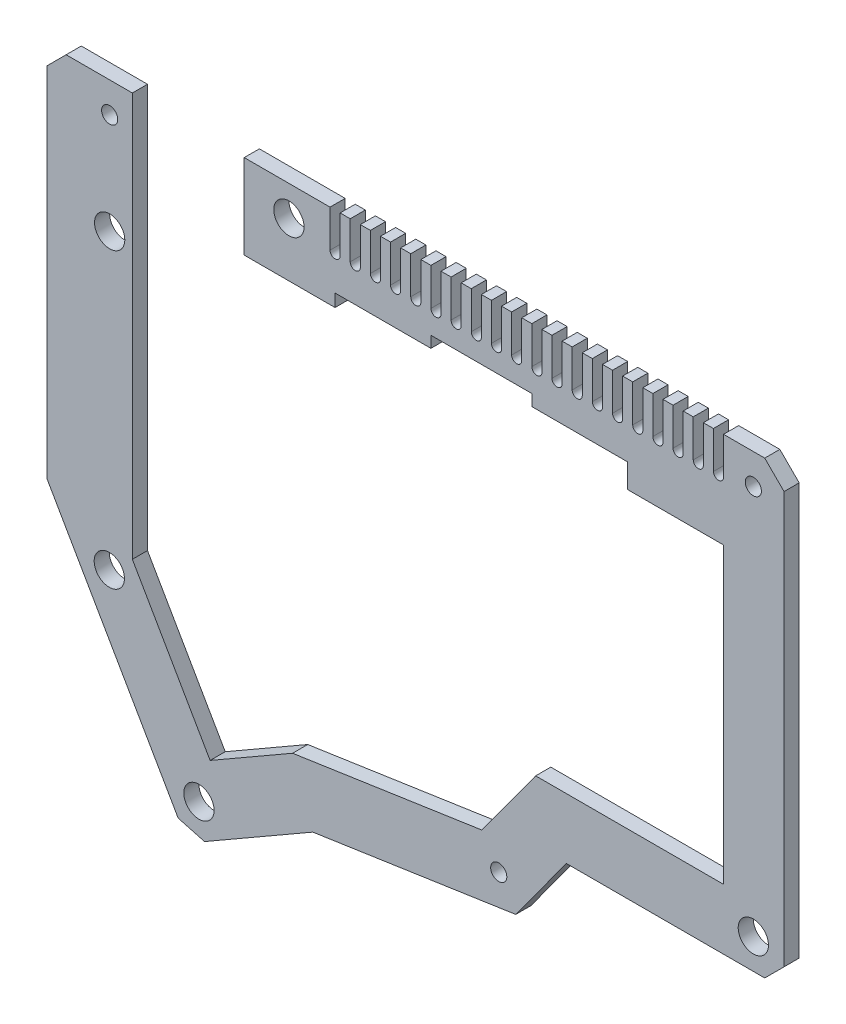
from build123d import *

# Parameters (mm, degrees)
BOSS_EXTRU_2_DEPTH      = 3
ENL_V_MAT_EXTRU_1_DEPTH = 3
ESQUISSE3_R             = 3
ESQUISSE3_R_2           = 1.6
ENL_V_MAT_EXTRU_3_DEPTH = 10


with BuildPart() as part:
    # Esquisse1 → Boss.-Extru.2 (new body)
    with BuildSketch(Plane.XY):
        Polygon((-140.02282508, -78.342807898), (-126.111124489, -102.556497988), (-109.761976756, -93.1463556), (-72.263087593, -87.572177036), (-61.577157206, -72.933633781), (-24.339106961, -72.933633781), (-24.339106961, -14.679643994), (-43.341802282, -14.679643994), (-43.341802282, -9.929307079), (-62.343149943, -9.929307079), (-62.343149943, -7.681038584), (-82.344426674, -7.679926158), (-82.344426674, -9.929307079), (-101.345774335, -9.929307079), (-101.345774335, -12.429484403), (-119.346382005, -12.429484403), (-119.346315028, 4.320852512), (-103.340940531, 4.320852512), (-96.344482292, 4.320852512), (-16.168669469, 4.316393314), (-12.339106961, 0.486617808), (-12.339106961, -81.105206657), (-16.167534085, -84.933633781), (-55.479847181, -84.933633781), (-65.531582138, -98.70339941), (-105.747438988, -104.681452952), (-127.216265437, -117.03834868), (-132.440036759, -115.628996046), (-158.478985875, -70.307502815), (-158.478985875, -3.429484403), (-158.478985875, 0.492425388), (-154.65055875, 4.320852512), (-141.52282508, 4.320852512), (-141.52282508, -75.180151251), (-141.52282508, -75.732017442), (-140.889904197, -76.833633309), align=None)
    extrude(amount=BOSS_EXTRU_2_DEPTH)

    # Esquisse2 → Enlèv. mat.-Extru.1 (cut)
    with BuildSketch(Plane.XY.offset(3)):
        with BuildLine():
            Line((-24.339106961, 4.316903353), (-24.339106961, -3.069258416))
            ThreePointArc((-24.339106961, -3.069258416), (-25.339106961, -4.069258416), (-26.339106961, -3.069258416))
            Line((-26.339106961, -3.069258416), (-26.339106961, 4.316903353))
            ThreePointArc((-26.339106961, 4.316903353), (-25.339106961, 5.316903353), (-24.339106961, 4.316903353))
        make_face()
        with BuildLine():
            Line((-28.339106961, 4.316903353), (-28.339106961, -3.069258416))
            ThreePointArc((-28.339106961, -3.069258416), (-29.339106961, -4.069258416), (-30.339106961, -3.069258416))
            Line((-30.339106961, -3.069258416), (-30.339106961, 4.316903353))
            ThreePointArc((-30.339106961, 4.316903353), (-29.339106961, 5.316903353), (-28.339106961, 4.316903353))
        make_face()
        with BuildLine():
            Line((-32.339106961, 4.316903353), (-32.339106961, -3.069258416))
            ThreePointArc((-32.339106961, -3.069258416), (-33.339106961, -4.069258416), (-34.339106961, -3.069258416))
            Line((-34.339106961, -3.069258416), (-34.339106961, 4.316903353))
            ThreePointArc((-34.339106961, 4.316903353), (-33.339106961, 5.316903353), (-32.339106961, 4.316903353))
        make_face()
        with BuildLine():
            Line((-36.339106961, 4.316903353), (-36.339106961, -3.069258416))
            ThreePointArc((-36.339106961, -3.069258416), (-37.339106961, -4.069258416), (-38.339106961, -3.069258416))
            Line((-38.339106961, -3.069258416), (-38.339106961, 4.316903353))
            ThreePointArc((-38.339106961, 4.316903353), (-37.339106961, 5.316903353), (-36.339106961, 4.316903353))
        make_face()
        with BuildLine():
            Line((-40.339106961, 4.316903353), (-40.339106961, -3.069258416))
            ThreePointArc((-40.339106961, -3.069258416), (-41.339106961, -4.069258416), (-42.339106961, -3.069258416))
            Line((-42.339106961, -3.069258416), (-42.339106961, 4.316903353))
            ThreePointArc((-42.339106961, 4.316903353), (-41.339106961, 5.316903353), (-40.339106961, 4.316903353))
        make_face()
        with BuildLine():
            Line((-44.339106961, 4.316903353), (-44.339106961, -3.069258416))
            ThreePointArc((-44.339106961, -3.069258416), (-45.339106961, -4.069258416), (-46.339106961, -3.069258416))
            Line((-46.339106961, -3.069258416), (-46.339106961, 4.316903353))
            ThreePointArc((-46.339106961, 4.316903353), (-45.339106961, 5.316903353), (-44.339106961, 4.316903353))
        make_face()
        with BuildLine():
            Line((-48.339106961, 4.316903353), (-48.339106961, -3.069258416))
            ThreePointArc((-48.339106961, -3.069258416), (-49.339106961, -4.069258416), (-50.339106961, -3.069258416))
            Line((-50.339106961, -3.069258416), (-50.339106961, 4.316903353))
            ThreePointArc((-50.339106961, 4.316903353), (-49.339106961, 5.316903353), (-48.339106961, 4.316903353))
        make_face()
        with BuildLine():
            Line((-52.339106961, 4.316903353), (-52.339106961, -3.069258416))
            ThreePointArc((-52.339106961, -3.069258416), (-53.339106961, -4.069258416), (-54.339106961, -3.069258416))
            Line((-54.339106961, -3.069258416), (-54.339106961, 4.316903353))
            ThreePointArc((-54.339106961, 4.316903353), (-53.339106961, 5.316903353), (-52.339106961, 4.316903353))
        make_face()
        with BuildLine():
            Line((-56.339106961, 4.316903353), (-56.339106961, -3.069258416))
            ThreePointArc((-56.339106961, -3.069258416), (-57.339106961, -4.069258416), (-58.339106961, -3.069258416))
            Line((-58.339106961, -3.069258416), (-58.339106961, 4.316903353))
            ThreePointArc((-58.339106961, 4.316903353), (-57.339106961, 5.316903353), (-56.339106961, 4.316903353))
        make_face()
        with BuildLine():
            Line((-60.339106961, 4.316903353), (-60.339106961, -3.069258416))
            ThreePointArc((-60.339106961, -3.069258416), (-61.339106961, -4.069258416), (-62.339106961, -3.069258416))
            Line((-62.339106961, -3.069258416), (-62.339106961, 4.316903353))
            ThreePointArc((-62.339106961, 4.316903353), (-61.339106961, 5.316903353), (-60.339106961, 4.316903353))
        make_face()
        with BuildLine():
            Line((-64.339106961, 4.316903353), (-64.339106961, -3.069258416))
            ThreePointArc((-64.339106961, -3.069258416), (-65.339106961, -4.069258416), (-66.339106961, -3.069258416))
            Line((-66.339106961, -3.069258416), (-66.339106961, 4.316903353))
            ThreePointArc((-66.339106961, 4.316903353), (-65.339106961, 5.316903353), (-64.339106961, 4.316903353))
        make_face()
        with BuildLine():
            Line((-68.339106961, 4.316903353), (-68.339106961, -3.069258416))
            ThreePointArc((-68.339106961, -3.069258416), (-69.339106961, -4.069258416), (-70.339106961, -3.069258416))
            Line((-70.339106961, -3.069258416), (-70.339106961, 4.316903353))
            ThreePointArc((-70.339106961, 4.316903353), (-69.339106961, 5.316903353), (-68.339106961, 4.316903353))
        make_face()
        with BuildLine():
            Line((-72.339106961, 4.316903353), (-72.339106961, -3.069258416))
            ThreePointArc((-72.339106961, -3.069258416), (-73.339106961, -4.069258416), (-74.339106961, -3.069258416))
            Line((-74.339106961, -3.069258416), (-74.339106961, 4.316903353))
            ThreePointArc((-74.339106961, 4.316903353), (-73.339106961, 5.316903353), (-72.339106961, 4.316903353))
        make_face()
        with BuildLine():
            Line((-76.339106961, 4.316903353), (-76.339106961, -3.069258416))
            ThreePointArc((-76.339106961, -3.069258416), (-77.339106961, -4.069258416), (-78.339106961, -3.069258416))
            Line((-78.339106961, -3.069258416), (-78.339106961, 4.316903353))
            ThreePointArc((-78.339106961, 4.316903353), (-77.339106961, 5.316903353), (-76.339106961, 4.316903353))
        make_face()
        with BuildLine():
            Line((-80.339106961, 4.316903353), (-80.339106961, -3.069258416))
            ThreePointArc((-80.339106961, -3.069258416), (-81.339106961, -4.069258416), (-82.339106961, -3.069258416))
            Line((-82.339106961, -3.069258416), (-82.339106961, 4.316903353))
            ThreePointArc((-82.339106961, 4.316903353), (-81.339106961, 5.316903353), (-80.339106961, 4.316903353))
        make_face()
        with BuildLine():
            Line((-84.339106961, 4.316903353), (-84.339106961, -3.069258416))
            ThreePointArc((-84.339106961, -3.069258416), (-85.339106961, -4.069258416), (-86.339106961, -3.069258416))
            Line((-86.339106961, -3.069258416), (-86.339106961, 4.316903353))
            ThreePointArc((-86.339106961, 4.316903353), (-85.339106961, 5.316903353), (-84.339106961, 4.316903353))
        make_face()
        with BuildLine():
            Line((-88.339106961, 4.316903353), (-88.339106961, -3.069258416))
            ThreePointArc((-88.339106961, -3.069258416), (-89.339106961, -4.069258416), (-90.339106961, -3.069258416))
            Line((-90.339106961, -3.069258416), (-90.339106961, 4.316903353))
            ThreePointArc((-90.339106961, 4.316903353), (-89.339106961, 5.316903353), (-88.339106961, 4.316903353))
        make_face()
        with BuildLine():
            Line((-92.339106961, 4.316903353), (-92.339106961, -3.069258416))
            ThreePointArc((-92.339106961, -3.069258416), (-93.339106961, -4.069258416), (-94.339106961, -3.069258416))
            Line((-94.339106961, -3.069258416), (-94.339106961, 4.316903353))
            ThreePointArc((-94.339106961, 4.316903353), (-93.339106961, 5.316903353), (-92.339106961, 4.316903353))
        make_face()
        with BuildLine():
            Line((-96.339106961, 4.316903353), (-96.339106961, -3.069258416))
            ThreePointArc((-96.339106961, -3.069258416), (-97.339106961, -4.069258416), (-98.339106961, -3.069258416))
            Line((-98.339106961, -3.069258416), (-98.339106961, 4.316903353))
            ThreePointArc((-98.339106961, 4.316903353), (-97.339106961, 5.316903353), (-96.339106961, 4.316903353))
        make_face()
        with BuildLine():
            Line((-100.339106961, 4.316903353), (-100.339106961, -3.069258416))
            ThreePointArc((-100.339106961, -3.069258416), (-101.339106961, -4.069258416), (-102.339106961, -3.069258416))
            Line((-102.339106961, -3.069258416), (-102.339106961, 4.316903353))
            ThreePointArc((-102.339106961, 4.316903353), (-101.339106961, 5.316903353), (-100.339106961, 4.316903353))
        make_face()
    extrude(amount=-ENL_V_MAT_EXTRU_1_DEPTH, mode=Mode.SUBTRACT)

    # Esquisse3 → Enlèv. mat.-Extru.3 (cut)
    with BuildSketch(Plane.XY):
        with Locations(Location((-110.487646531, -1.678365923, 0), (0, 0, 180))):
            Circle(ESQUISSE3_R)
        with Locations(Location((-146.0923789, -79.822656053, 0), (0, 0, 180))):
            Circle(ESQUISSE3_R)
        with Locations(Location((-128.322250168, -110.752044388, 0), (0, 0, 180))):
            Circle(ESQUISSE3_R)
        with Locations(Location((-18.429668504, -78.933633781, 0), (0, 0, 180))):
            Circle(ESQUISSE3_R)
        with Locations(Location((-68.897334865, -93.137788223, 0), (0, 0, 180))):
            Circle(ESQUISSE3_R_2)
        with Locations(Location((-146.02282508, -1.677868186, 0), (0, 0, 180))):
            Circle(ESQUISSE3_R_2)
        with Locations(Location((-18.429668504, -1.684542717, 0), (0, 0, 180))):
            Circle(ESQUISSE3_R_2)
        with Locations(Location((-146.02282508, -21.677868186, 0), (0, 0, 180))):
            Circle(ESQUISSE3_R)
    extrude(amount=ENL_V_MAT_EXTRU_3_DEPTH, mode=Mode.SUBTRACT)


solid = part.part
